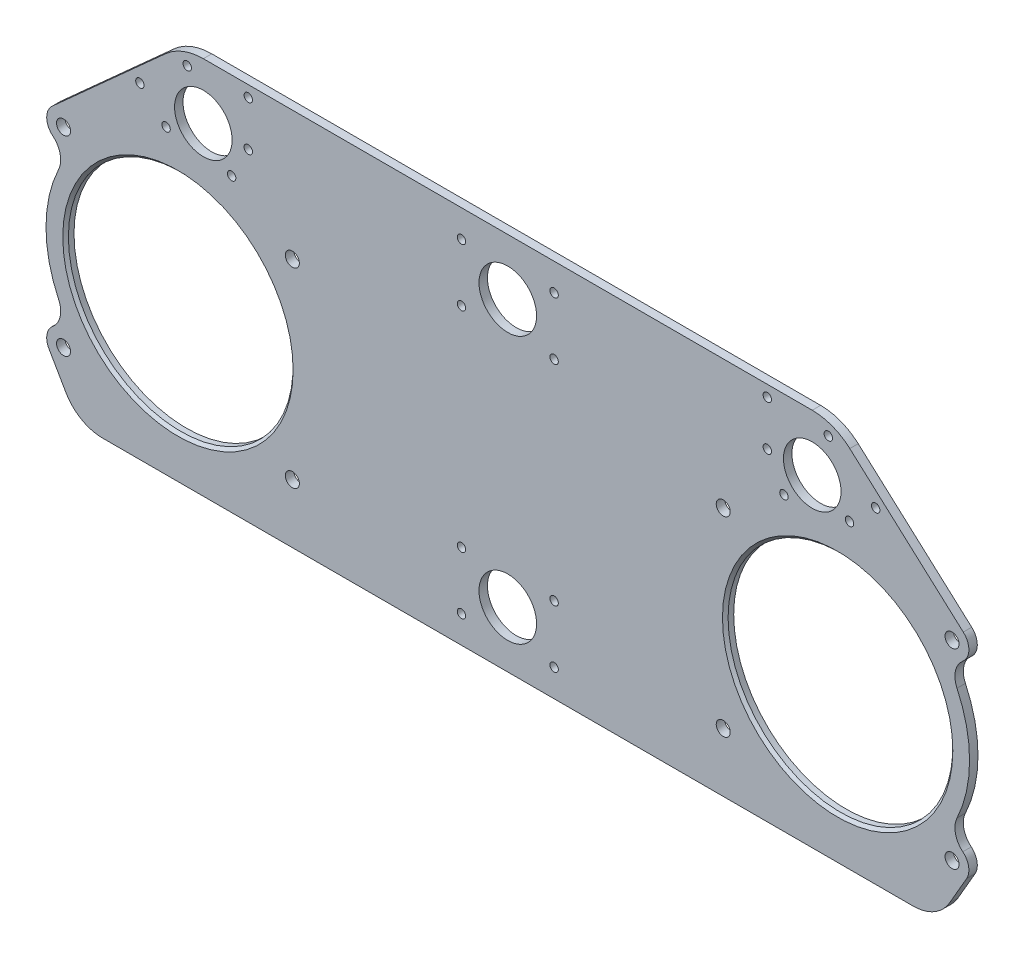
from build123d import *

# Parameters (mm, degrees)
SKETCH_1_R               = 40.028115119
EXTRUDE_1_DEPTH          = 3
CHAMFER_1_SIZE           = 1
CUT_EXTRUDE_1_DEPTH      = 294.143309663
CUT_EXTRUDE_1_DEPTH_BACK = 294.143309663
SKETCH_2_R               = 2.5
CUT_EXTRUDE_2_DEPTH      = 294.143309663
CUT_EXTRUDE_2_DEPTH_BACK = 294.143309663
SKETCH_3_R               = 10.25
CUT_EXTRUDE_3_DEPTH      = 294.143309663
CUT_EXTRUDE_3_DEPTH_BACK = 294.143309663
SKETCH_4_R               = 1.5
CUT_EXTRUDE_4_DEPTH      = 294.143309663
CUT_EXTRUDE_4_DEPTH_BACK = 294.143309663
SKETCH_5_R               = 1.5
CUT_EXTRUDE_5_DEPTH      = 294.143309663
CUT_EXTRUDE_5_DEPTH_BACK = 294.143309663
SKETCH_6_R               = 1.5


with BuildPart() as part:
    # 草图1 → 凸台-拉伸1 (new body)
    with BuildSketch(Plane.XY):
        with BuildLine():
            Line((44.764783638, 38.458868953), (4.334015044, 74.86289651))
            ThreePointArc((4.334015044, 74.86289651), (-1.881238093, 78.67160853), (-9.048597084, 80))
            Line((-9.048597084, 80), (-225.951402916, 80))
            ThreePointArc((-225.951402916, 80), (-233.118761907, 78.67160853), (-239.334015044, 74.86289651))
            Line((-239.334015044, 74.86289651), (-279.764783638, 38.458868953))
            ThreePointArc((-279.764783638, 38.458868953), (-281.748934241, 33.886916076), (-279.593885752, 29.392989871))
            ThreePointArc((-279.593885752, 29.392989871), (-276.958783906, 25.06173547), (-277.521429039, 20.023188369))
            ThreePointArc((-277.521429039, 20.023188369), (-282, 0), (-277.521429039, -20.023188369))
            ThreePointArc((-277.521429039, -20.023188369), (-276.958783906, -25.06173547), (-279.593885752, -29.392989871))
            ThreePointArc((-279.593885752, -29.392989871), (-281.657387183, -32.949868258), (-280.946152423, -37))
            Line((-280.946152423, -37), (-274.883974596, -47.5))
            ThreePointArc((-274.883974596, -47.5), (-269.393593539, -52.990381057), (-261.893593539, -55))
            Line((-261.893593539, -55), (26.893593539, -55))
            ThreePointArc((26.893593539, -55), (34.393593539, -52.990381057), (39.883974596, -47.5))
            Line((39.883974596, -47.5), (45.946152423, -37))
            ThreePointArc((45.946152423, -37), (46.657387183, -32.949868258), (44.593885752, -29.392989871))
            ThreePointArc((44.593885752, -29.392989871), (41.958783906, -25.06173547), (42.521429039, -20.023188369))
            ThreePointArc((42.521429039, -20.023188369), (47, 0), (42.521429039, 20.023188369))
            ThreePointArc((42.521429039, 20.023188369), (41.958783906, 25.06173547), (44.593885752, 29.392989871))
            ThreePointArc((44.593885752, 29.392989871), (46.748934241, 33.886916076), (44.764783638, 38.458868953))
        make_face()
        with Locations(Location((0, 0, 0), (0, 0, 180))):
            Circle(SKETCH_1_R, mode=Mode.SUBTRACT)
        with Locations(Location((-235, 0, 0), (0, 0, 180))):
            Circle(SKETCH_1_R, mode=Mode.SUBTRACT)
    extrude(amount=EXTRUDE_1_DEPTH)

    # 倒角1
    chamfer_1_edges = [part.edges().sort_by_distance(p)[0] for p in [
        (40.028115119, 0, 3),
        (-194.971884881, 0, 3),
    ]]
    chamfer(chamfer_1_edges, length=CHAMFER_1_SIZE)

    # 草图2 → 切除-拉伸1 (cut, two sides: drawn at the far end of the back side and taken through both)
    with BuildSketch(Plane(origin=(0, 0, 0), x_dir=(-1, 0, 0), z_dir=(0, 0, -1)).offset(-CUT_EXTRUDE_1_DEPTH_BACK)):
        with Locations((40.75, -34)):
            Circle(SKETCH_2_R)
        with Locations((40.75, 34)):
            Circle(SKETCH_2_R)
        with Locations((-40.75, 34)):
            Circle(SKETCH_2_R)
        with Locations((-40.75, -34)):
            Circle(SKETCH_2_R)
        with Locations((275.75, -34)):
            Circle(SKETCH_2_R)
        with Locations((275.75, 34)):
            Circle(SKETCH_2_R)
        with Locations((194.25, 34)):
            Circle(SKETCH_2_R)
        with Locations((194.25, -34)):
            Circle(SKETCH_2_R)
    extrude(amount=CUT_EXTRUDE_1_DEPTH + CUT_EXTRUDE_1_DEPTH_BACK, mode=Mode.SUBTRACT)

    # 草图3 → 切除-拉伸2 (cut, two sides: drawn at the far end of the back side and taken through both)
    with BuildSketch(Plane.XY.offset(3).offset(-CUT_EXTRUDE_2_DEPTH_BACK)):
        with Locations((-117.5, -35)):
            Circle(SKETCH_3_R)
        with Locations((-225.951402916, 60)):
            Circle(SKETCH_3_R)
        with Locations((-117.5, 60)):
            Circle(SKETCH_3_R)
        with Locations((-9.048597084, 60)):
            Circle(SKETCH_3_R)
    extrude(amount=CUT_EXTRUDE_2_DEPTH + CUT_EXTRUDE_2_DEPTH_BACK, mode=Mode.SUBTRACT)

    # 草图4 → 切除-拉伸3 (cut, two sides: drawn at the far end of the back side and taken through both)
    with BuildSketch(Plane(origin=(0, 0, 0), x_dir=(-1, 0, 0), z_dir=(0, 0, -1)).offset(-CUT_EXTRUDE_3_DEPTH_BACK)):
        with Locations((134, -24.75)):
            Circle(SKETCH_4_R)
        with Locations((134, -45.25)):
            Circle(SKETCH_4_R)
        with Locations((101, -45.25)):
            Circle(SKETCH_4_R)
        with Locations((101, -24.75)):
            Circle(SKETCH_4_R)
    extrude(amount=CUT_EXTRUDE_3_DEPTH + CUT_EXTRUDE_3_DEPTH_BACK, mode=Mode.SUBTRACT)

    # 草图5 → 切除-拉伸4 (cut, two sides: drawn at the far end of the back side and taken through both)
    with BuildSketch(Plane(origin=(0, 0, 0), x_dir=(-1, 0, 0), z_dir=(0, 0, -1)).offset(-CUT_EXTRUDE_4_DEPTH_BACK)):
        with Locations((19.128165824, 48.891341485)):
            Circle(SKETCH_5_R)
        with Locations((25.048597084, 60)):
            Circle(SKETCH_5_R)
        with Locations((25.048597084, 76)):
            Circle(SKETCH_5_R)
        with Locations((3.314709891, 74.937286824)):
            Circle(SKETCH_5_R)
        with Locations((-13.547809826, 61.184227506)):
            Circle(SKETCH_5_R)
        with Locations((-4.229232955, 52.329375962)):
            Circle(SKETCH_5_R)
        with Locations((209.951402916, 60)):
            Circle(SKETCH_5_R)
        with Locations((215.871834176, 48.891341485)):
            Circle(SKETCH_5_R)
        with Locations((239.229232955, 52.329375962)):
            Circle(SKETCH_5_R)
        with Locations((248.547809826, 61.184227506)):
            Circle(SKETCH_5_R)
        with Locations((209.951402916, 76)):
            Circle(SKETCH_5_R)
        with Locations((231.685290109, 74.937286824)):
            Circle(SKETCH_5_R)
    extrude(amount=CUT_EXTRUDE_4_DEPTH + CUT_EXTRUDE_4_DEPTH_BACK, mode=Mode.SUBTRACT)

    # 草图6 → 切除-拉伸5 (cut, two sides: drawn at the far end of the back side and taken through both)
    with BuildSketch(Plane(origin=(0, 0, 0), x_dir=(-1, 0, 0), z_dir=(0, 0, -1)).offset(-CUT_EXTRUDE_5_DEPTH_BACK)):
        with Locations((134, 70.25)):
            Circle(SKETCH_6_R)
        with Locations((134, 49.75)):
            Circle(SKETCH_6_R)
        with Locations((101, 70.25)):
            Circle(SKETCH_6_R)
        with Locations((101, 49.75)):
            Circle(SKETCH_6_R)
    extrude(amount=CUT_EXTRUDE_5_DEPTH + CUT_EXTRUDE_5_DEPTH_BACK, mode=Mode.SUBTRACT)


solid = part.part
